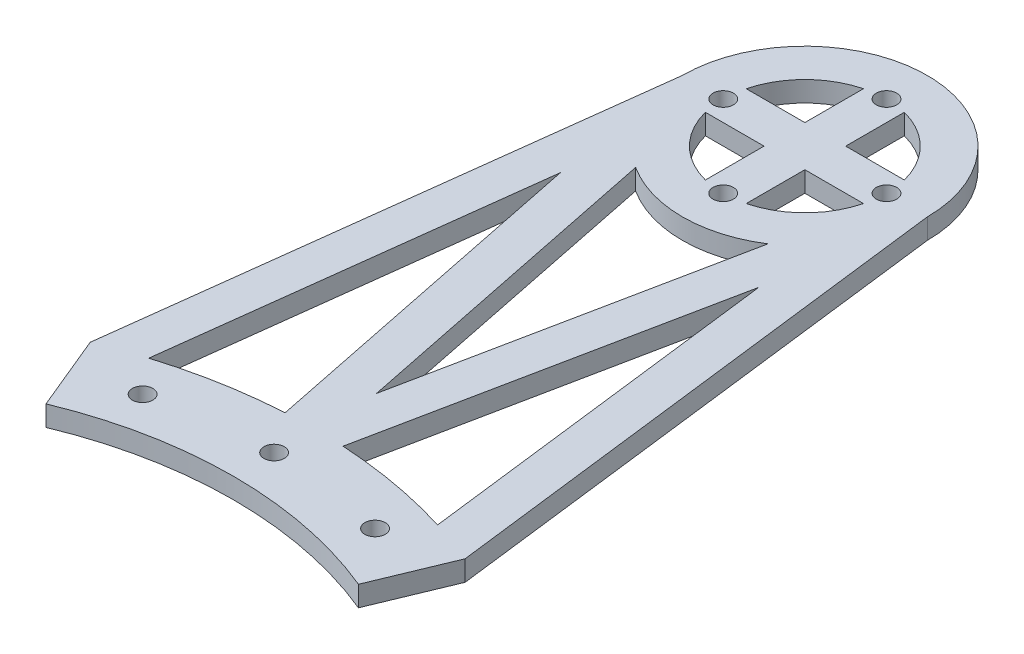
from build123d import *

# Parameters (mm, degrees)
SKETCH1_R           = 1.5875
SKETCH1_R_2         = 1.587499999
BOSS_EXTRUDE1_DEPTH = 3.175


with BuildPart() as part:
    # Sketch1 → Boss-Extrude1 (new body)
    with BuildSketch(Plane(origin=(0, 0, 0), x_dir=(1, 0, 0), z_dir=(0, 1, 0))):
        with BuildLine():
            Line((-19.05, 152.4), (-29.160477546, 70.399620377))
            Line((-29.160477546, 70.399620377), (-24.300397955, 58.666350314))
            ThreePointArc((-24.300397955, 58.666350314), (0, 63.5), (24.300397955, 58.666350314))
            Line((24.300397955, 58.666350314), (29.160477546, 70.399620377))
            Line((29.160477546, 70.399620377), (19.05, 152.4))
            ThreePointArc((19.05, 152.4), (0, 171.45), (-19.05, 152.4))
        make_face()
        with Locations(Location((0, 139.7, 0), (0, 0, 270))):
            Circle(SKETCH1_R, mode=Mode.SUBTRACT)
        with Locations(Location((-12.7, 152.4, 0), (0, 0, 270))):
            Circle(SKETCH1_R, mode=Mode.SUBTRACT)
        with Locations(Location((0, 69.85, 0), (0, 0, 270))):
            Circle(SKETCH1_R, mode=Mode.SUBTRACT)
        with Locations(Location((18.0785103, 67.469918962, 0), (0, 0, 270))):
            Circle(SKETCH1_R, mode=Mode.SUBTRACT)
        with Locations(Location((0, 165.1, 0), (0, 0, 270))):
            Circle(SKETCH1_R, mode=Mode.SUBTRACT)
        with Locations(Location((12.7, 152.4, 0), (0, 0, 270))):
            Circle(SKETCH1_R, mode=Mode.SUBTRACT)
        with Locations(Location((-18.078510302, 67.469918971, 0), (0, 0, 270))):
            Circle(SKETCH1_R_2, mode=Mode.SUBTRACT)
        with BuildLine():
            Line((-15.438109232, 129.802746381), (-4.504911756, 76.066719201))
            ThreePointArc((-4.504911756, 76.066719201), (-13.582616579, 74.97968076), (-22.464793382, 72.813275289))
            Line((-22.464793382, 72.813275289), (-15.438109232, 129.802746381))
        make_face(mode=Mode.SUBTRACT)
        with BuildLine():
            Line((-10.294399454, 136.371031229), (0, 85.774659025))
            Line((0, 85.774659025), (10.294399454, 136.371031229))
            ThreePointArc((10.294399454, 136.371031229), (0, 133.35), (-10.294399454, 136.371031229))
        make_face(mode=Mode.SUBTRACT)
        with BuildLine():
            Line((12.296722124, 155.575), (3.175, 155.575))
            Line((3.175, 155.575), (3.175, 164.696722124))
            ThreePointArc((3.175, 164.696722124), (8.980256121, 161.380256121), (12.296722124, 155.575))
        make_face(mode=Mode.SUBTRACT)
        with BuildLine():
            Line((-3.175, 149.225), (-12.296722124, 149.225))
            ThreePointArc((-12.296722124, 149.225), (-8.980256121, 143.419743879), (-3.175, 140.103277876))
            Line((-3.175, 140.103277876), (-3.175, 149.225))
        make_face(mode=Mode.SUBTRACT)
        with BuildLine():
            Line((12.296722124, 149.225), (3.175, 149.225))
            Line((3.175, 149.225), (3.175, 140.103277876))
            ThreePointArc((3.175, 140.103277876), (8.980256121, 143.419743879), (12.296722124, 149.225))
        make_face(mode=Mode.SUBTRACT)
        with BuildLine():
            Line((4.504911756, 76.066719201), (15.438109232, 129.802746381))
            Line((15.438109232, 129.802746381), (22.464793382, 72.813275289))
            ThreePointArc((22.464793382, 72.813275289), (13.582616579, 74.97968076), (4.504911756, 76.066719201))
        make_face(mode=Mode.SUBTRACT)
        with BuildLine():
            Line((-3.175, 155.575), (-3.175, 164.696722124))
            ThreePointArc((-3.175, 164.696722124), (-8.980256121, 161.380256121), (-12.296722124, 155.575))
            Line((-12.296722124, 155.575), (-3.175, 155.575))
        make_face(mode=Mode.SUBTRACT)
    extrude(amount=BOSS_EXTRUDE1_DEPTH)


solid = part.part
